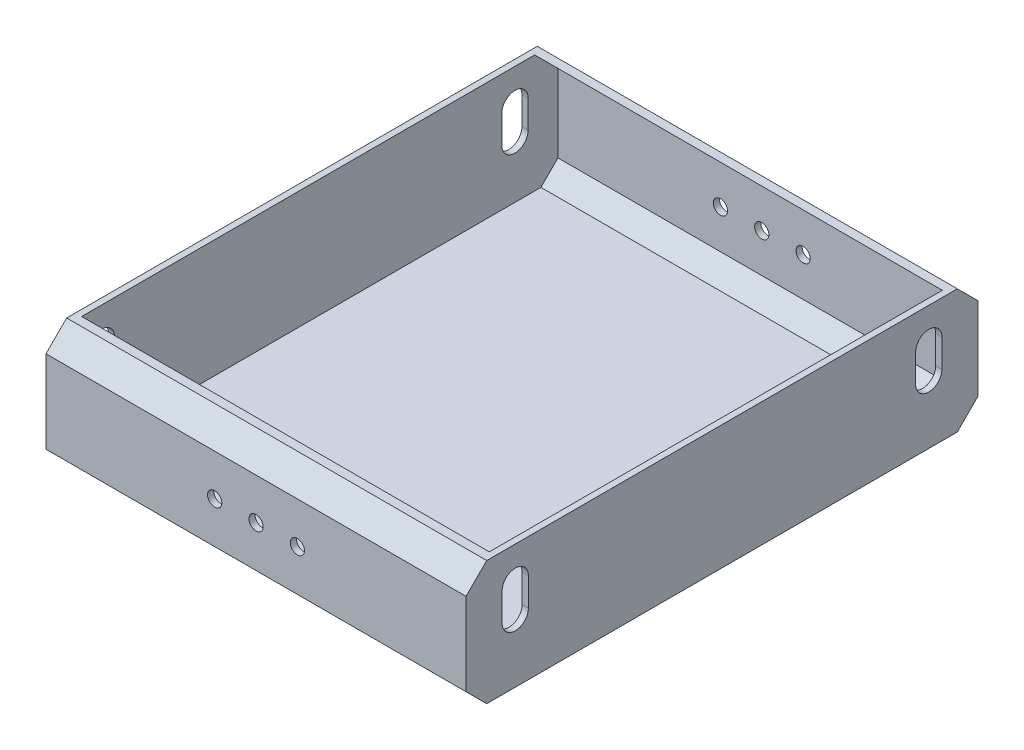
from build123d import *

# Parameters (mm, degrees)
SKETCH1_W                                = 203.2
SKETCH1_H                                = 247.65
BOSS_EXTRUDE1_DEPTH                      = 60
CHAMFER1_SIZE                            = 10
SHELL3_T                                 = -3
CUT_EXTRUDE1_REACH                       = 247.403
MIRROR1_AT_THE_SECOND_PLANE_COPY_1_REACH = 247.403
CUT_EXTRUDE2_REACH                       = 276.323
SKETCH3_R                                = 3.45


with BuildPart() as part:
    # Sketch1 → Boss-Extrude1 (new body)
    with BuildSketch(Plane(origin=(0, 0, 0), x_dir=(1, 0, 0), z_dir=(0, 1, 0))):
        Rectangle(SKETCH1_W, SKETCH1_H)
    extrude(amount=BOSS_EXTRUDE1_DEPTH)

    # Chamfer1
    chamfer1_edges = [part.edges().sort_by_distance(p)[0] for p in [
        (0, 60, 123.825),
        (0, 0, 123.825),
        (0, 0, -123.825),
        (0, 60, -123.825),
    ]]
    chamfer(chamfer1_edges, length=CHAMFER1_SIZE)

    # Shell3
    shell3_openings = [part.faces().sort_by_distance(p)[0] for p in [
        (0, 60, 0),
    ]]
    offset(amount=SHELL3_T, openings=shell3_openings, kind=Kind.INTERSECTION)

    # Sketch2 → Cut-Extrude1 (cut, up to next)
    with BuildSketch(Plane.ZY.offset(101.6), mode=Mode.PRIVATE) as cut_extrude1_sk1:
        with BuildLine():
            Line((-93.675, 43.55), (-93.675, 30))
            ThreePointArc((-93.675, 30), (-100.025, 23.65), (-106.375, 30))
            Line((-106.375, 30), (-106.375, 43.55))
            ThreePointArc((-106.375, 43.55), (-100.025, 49.9), (-93.675, 43.55))
        make_face()
    cut_extrude1_tool1 = extrude(cut_extrude1_sk1.sketch, amount=-CUT_EXTRUDE1_REACH, mode=Mode.PRIVATE) & part.part
    cut_extrude1 = cut_extrude1_tool1.solids().sort_by_distance((-101.6, 36.775, -100.025))[0]
    add(cut_extrude1, mode=Mode.SUBTRACT)

    # Mirror1: Cut-Extrude1 across plane
    add(cut_extrude1.mirror(Plane.XY), mode=Mode.SUBTRACT)

    # Mirror1 at the second plane: Cut-Extrude1 across plane
    add(cut_extrude1.mirror(Plane(origin=(0, 0, 0), x_dir=(0, 0, 1), z_dir=(1, 0, 0))), mode=Mode.SUBTRACT)

    # Mirror1 at the second plane copy 1 sketc → Mirror1 at the second plane copy 1 (cut, up to next)
    with BuildSketch(Plane(origin=(101.6, 0, 0), x_dir=(0, 0, -1), z_dir=(1, 0, 0)), mode=Mode.PRIVATE) as mirror1_at_the_second_plane_copy_1_sk1:
        with BuildLine():
            Line((-93.675, 43.55), (-93.675, 30))
            ThreePointArc((-93.675, 30), (-100.025, 23.65), (-106.375, 30))
            Line((-106.375, 30), (-106.375, 43.55))
            ThreePointArc((-106.375, 43.55), (-100.025, 49.9), (-93.675, 43.55))
        make_face()
    mirror1_at_the_second_plane_copy_1_tool1 = extrude(mirror1_at_the_second_plane_copy_1_sk1.sketch, amount=-MIRROR1_AT_THE_SECOND_PLANE_COPY_1_REACH, mode=Mode.PRIVATE) & part.part
    add(mirror1_at_the_second_plane_copy_1_tool1.solids().sort_by_distance((101.6, 36.775, 100.025))[0], mode=Mode.SUBTRACT)

    # Sketch3 → Cut-Extrude2 (cut, up to next)
    with BuildSketch(Plane(origin=(0, 0, -123.825), x_dir=(-1, 0, 0), z_dir=(0, 0, -1)), mode=Mode.PRIVATE) as cut_extrude2_sk1:
        with Locations((0, 30)):
            Circle(SKETCH3_R)
    cut_extrude2_tool1 = extrude(cut_extrude2_sk1.sketch, amount=-CUT_EXTRUDE2_REACH, mode=Mode.PRIVATE) & part.part
    # Sketch3 → Cut-Extrude2 (cut, up to next)
    with BuildSketch(Plane(origin=(0, 0, -123.825), x_dir=(-1, 0, 0), z_dir=(0, 0, -1)), mode=Mode.PRIVATE) as cut_extrude2_sk2:
        with Locations((20, 30)):
            Circle(SKETCH3_R)
    cut_extrude2_tool2 = extrude(cut_extrude2_sk2.sketch, amount=-CUT_EXTRUDE2_REACH, mode=Mode.PRIVATE) & part.part
    # Sketch3 → Cut-Extrude2 (cut, up to next)
    with BuildSketch(Plane(origin=(0, 0, -123.825), x_dir=(-1, 0, 0), z_dir=(0, 0, -1)), mode=Mode.PRIVATE) as cut_extrude2_sk3:
        with Locations((-20, 30)):
            Circle(SKETCH3_R)
    cut_extrude2_tool3 = extrude(cut_extrude2_sk3.sketch, amount=-CUT_EXTRUDE2_REACH, mode=Mode.PRIVATE) & part.part
    cut_extrude2_1 = cut_extrude2_tool1.solids().sort_by_distance((0, 30, -123.825))[0]
    add(cut_extrude2_1, mode=Mode.SUBTRACT)
    cut_extrude2_2 = cut_extrude2_tool2.solids().sort_by_distance((-20, 30, -123.825))[0]
    add(cut_extrude2_2, mode=Mode.SUBTRACT)
    cut_extrude2_3 = cut_extrude2_tool3.solids().sort_by_distance((20, 30, -123.825))[0]
    add(cut_extrude2_3, mode=Mode.SUBTRACT)
    cut_extrude2 = cut_extrude2_1 + cut_extrude2_2 + cut_extrude2_3  # Cut-Extrude2 as one shape, for the pattern or mirror that repeats it

    # Mirror2: Cut-Extrude2 across plane
    add(cut_extrude2.mirror(Plane.XY), mode=Mode.SUBTRACT)


solid = part.part
